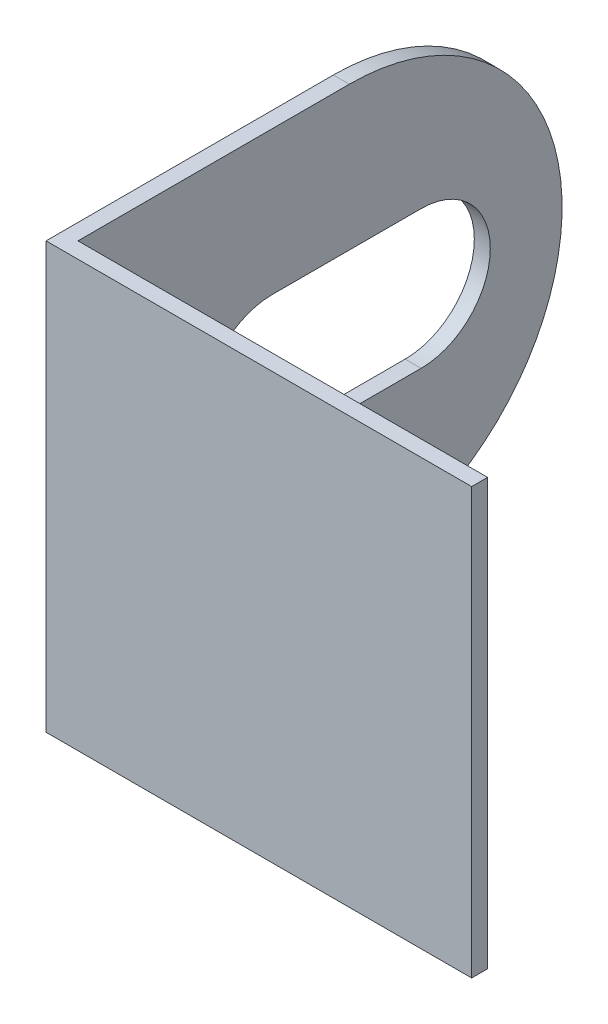
from build123d import *

# Parameters (mm, degrees)
BOSS_EXTRUDE1_DEPTH = 40
CUT_EXTRUDE1_DEPTH  = 40


with BuildPart() as part:
    # Sketch1 → Boss-Extrude1 (new body)
    with BuildSketch(Plane(origin=(0, 0, 0), x_dir=(1, 0, 0), z_dir=(0, 1, 0))):
        Polygon((-18.5, 23.5), (-18.5, -22), (20, -22), (20, -23.5), (-20, -23.5), (-20, 23.5), align=None)
    extrude(amount=BOSS_EXTRUDE1_DEPTH)

    # Sketch2 → Cut-Extrude1 (cut)
    with BuildSketch(Plane.ZY.offset(20)):
        with BuildLine():
            Line((-23.5, 0), (-3.5, 0))
            ThreePointArc((-3.5, 0), (-17.642135624, 5.857864376), (-23.5, 20))
            Line((-23.5, 20), (-23.5, 0))
        make_face()
        with BuildLine():
            Line((-23.5, 40), (-23.5, 20))
            ThreePointArc((-23.5, 20), (-17.642135624, 34.142135624), (-3.5, 40))
            Line((-3.5, 40), (-23.5, 40))
        make_face()
        with BuildLine():
            Line((-10.25, 13.5), (3.75, 13.5))
            ThreePointArc((3.75, 13.5), (10.25, 20), (3.75, 26.5))
            Line((3.75, 26.5), (-10.25, 26.5))
            ThreePointArc((-10.25, 26.5), (-16.75, 20), (-10.25, 13.5))
        make_face()
    extrude(amount=-CUT_EXTRUDE1_DEPTH, mode=Mode.SUBTRACT)


solid = part.part
